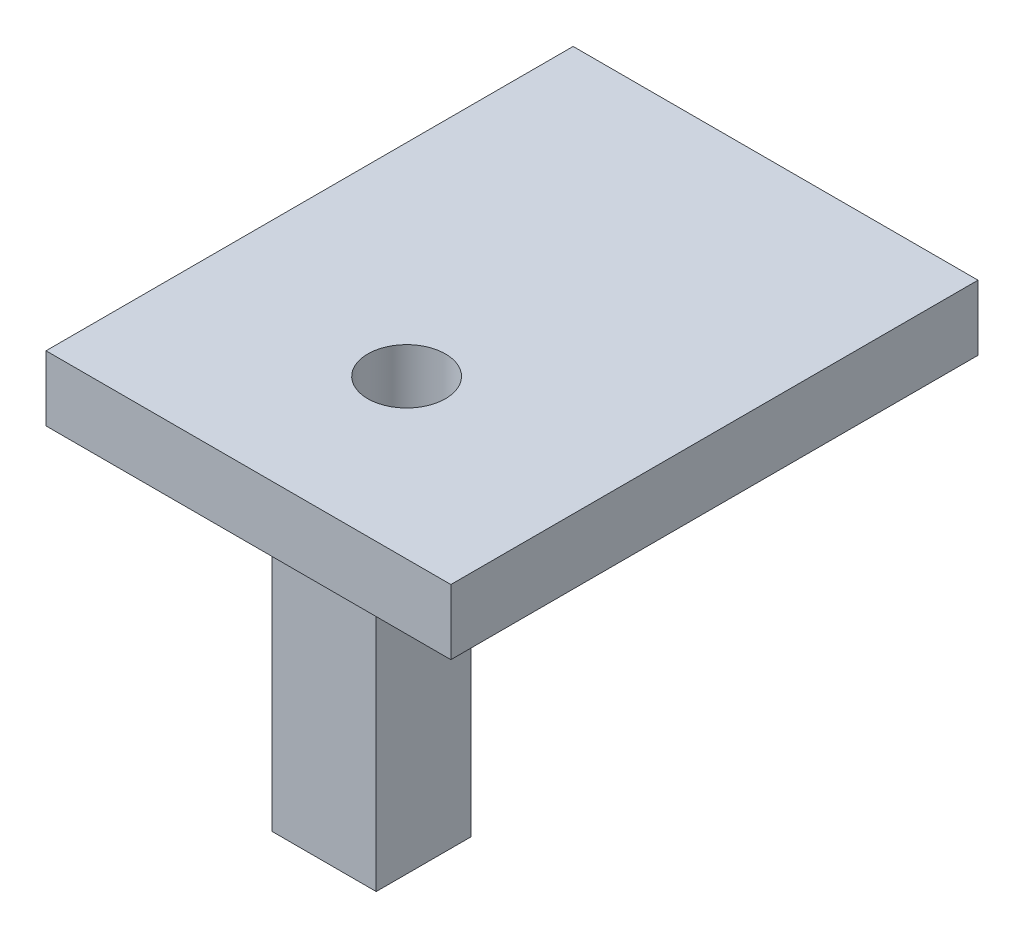
from build123d import *

# Parameters (mm, degrees)
SKETCH1_W           = 62.2
SKETCH1_H           = 80.98413
BOSS_EXTRUDE1_DEPTH = 10
SKETCH2_R           = 5.969
CUT_EXTRUDE1_DEPTH  = 10
SKETCH3_W           = 16
SKETCH3_H           = 14.55264
BOSS_EXTRUDE2_DEPTH = 71.32


with BuildPart() as part:
    # Sketch1 → Boss-Extrude1 (new body)
    with BuildSketch(Plane(origin=(0, 0, 0), x_dir=(1, 0, 0), z_dir=(0, 1, 0))):
        Rectangle(SKETCH1_W, SKETCH1_H)
    extrude(amount=BOSS_EXTRUDE1_DEPTH)

    # Sketch2 → Cut-Extrude1 (cut)
    with BuildSketch(Plane(origin=(0, 10, 0), x_dir=(1, 0, 0), z_dir=(0, 1, 0))):
        with Locations(Location((0, -16.192065, 0), (0, 0, 270))):
            Circle(SKETCH2_R)
    extrude(amount=-CUT_EXTRUDE1_DEPTH, mode=Mode.SUBTRACT)

    # Sketch3 → Boss-Extrude2 (add)
    with BuildSketch(Plane.XZ):
        with Locations((-23.1, -1.515745)):
            Rectangle(SKETCH3_W, SKETCH3_H)
    extrude(amount=BOSS_EXTRUDE2_DEPTH)


solid = part.part
